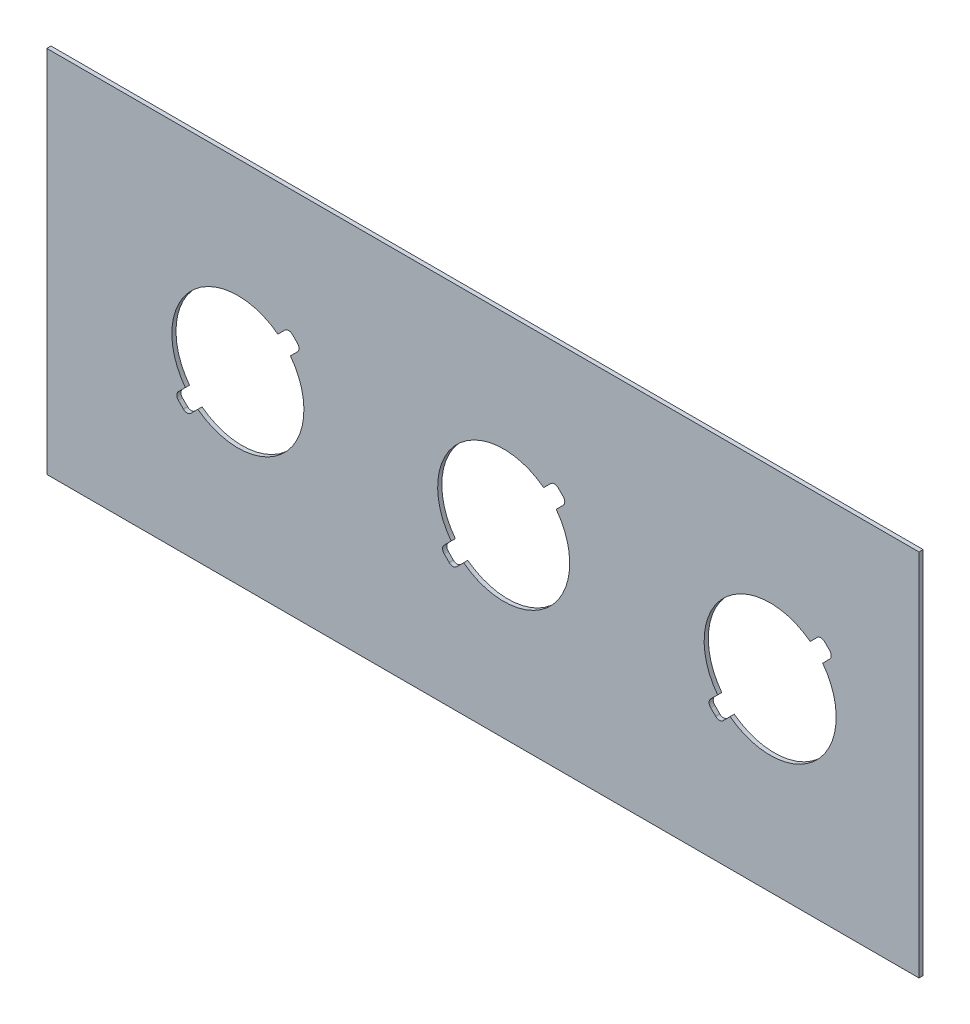
from build123d import *

# Parameters (mm, degrees)
SKETCH1_W           = 330.2
SKETCH1_H           = 139.7
BOSS_EXTRUDE1_DEPTH = 1.5748
SKETCH6_R           = 25
CUT_EXTRUDE3_DEPTH  = 180.27496338
CUT_EXTRUDE4_DEPTH  = 4


with BuildPart() as part:
    # Sketch1 → Boss-Extrude1 (new body)
    with BuildSketch(Plane.XY):
        Rectangle(SKETCH1_W, SKETCH1_H)
    extrude(amount=BOSS_EXTRUDE1_DEPTH)

    # Sketch6 → Cut-Extrude3 (cut, through all)
    with BuildSketch(Plane.XY.offset(1.5748)):
        with Locations((108.75, 0)):
            Circle(SKETCH6_R)
        with Locations((7.861, 0)):
            Circle(SKETCH6_R)
        with Locations((-92.774, 0)):
            Circle(SKETCH6_R)
    extrude(amount=-CUT_EXTRUDE3_DEPTH, mode=Mode.SUBTRACT)

    # Sketch8 → Cut-Extrude4 (cut)
    with BuildSketch(Plane.XY.offset(1.5748)):
        with BuildLine():
            Line((88.120489669, -22.53869864), (86.21130136, -20.629510331))
            ThreePointArc((86.21130136, -20.629510331), (85.625514922, -19.215296769), (86.21130136, -17.801083206))
            Line((86.21130136, -17.801083206), (88.862951789, -15.149432777))
            ThreePointArc((88.862951789, -15.149432777), (91.07233047, -17.67766953), (93.600567223, -19.887048211))
            Line((93.600567223, -19.887048211), (90.948916794, -22.53869864))
            ThreePointArc((90.948916794, -22.53869864), (89.534703231, -23.124485078), (88.120489669, -22.53869864))
        make_face()
        with BuildLine():
            Line((131.28869864, 17.801083206), (128.637048211, 15.149432777))
            ThreePointArc((128.637048211, 15.149432777), (126.42766953, 17.67766953), (123.899432777, 19.887048211))
            Line((123.899432777, 19.887048211), (126.551083206, 22.53869864))
            ThreePointArc((126.551083206, 22.53869864), (127.965296769, 23.124485078), (129.379510331, 22.53869864))
            Line((129.379510331, 22.53869864), (131.28869864, 20.629510331))
            ThreePointArc((131.28869864, 20.629510331), (131.874485078, 19.215296769), (131.28869864, 17.801083206))
        make_face()
        with BuildLine():
            Line((30.39969864, 17.801083206), (27.748048211, 15.149432777))
            ThreePointArc((27.748048211, 15.149432777), (25.53866953, 17.67766953), (23.010432777, 19.887048211))
            Line((23.010432777, 19.887048211), (25.662083206, 22.53869864))
            ThreePointArc((25.662083206, 22.53869864), (27.076296769, 23.124485078), (28.490510331, 22.53869864))
            Line((28.490510331, 22.53869864), (30.39969864, 20.629510331))
            ThreePointArc((30.39969864, 20.629510331), (30.985485078, 19.215296769), (30.39969864, 17.801083206))
        make_face()
        with BuildLine():
            Line((-7.288432777, -19.887048211), (-9.940083206, -22.53869864))
            ThreePointArc((-9.940083206, -22.53869864), (-11.354296769, -23.124485078), (-12.768510331, -22.53869864))
            Line((-12.768510331, -22.53869864), (-14.67769864, -20.629510331))
            ThreePointArc((-14.67769864, -20.629510331), (-15.263485078, -19.215296769), (-14.67769864, -17.801083206))
            Line((-14.67769864, -17.801083206), (-12.026048211, -15.149432777))
            ThreePointArc((-12.026048211, -15.149432777), (-9.81666953, -17.67766953), (-7.288432777, -19.887048211))
        make_face()
        with BuildLine():
            Line((-115.31269864, -17.801083206), (-112.661048211, -15.149432777))
            ThreePointArc((-112.661048211, -15.149432777), (-110.45166953, -17.67766953), (-107.923432777, -19.887048211))
            Line((-107.923432777, -19.887048211), (-110.575083206, -22.53869864))
            ThreePointArc((-110.575083206, -22.53869864), (-111.989296769, -23.124485078), (-113.403510331, -22.53869864))
            Line((-113.403510331, -22.53869864), (-115.31269864, -20.629510331))
            ThreePointArc((-115.31269864, -20.629510331), (-115.898485078, -19.215296769), (-115.31269864, -17.801083206))
        make_face()
        with BuildLine():
            Line((-70.23530136, 17.801083206), (-72.886951789, 15.149432777))
            ThreePointArc((-72.886951789, 15.149432777), (-75.09633047, 17.67766953), (-77.624567223, 19.887048211))
            Line((-77.624567223, 19.887048211), (-74.972916794, 22.53869864))
            ThreePointArc((-74.972916794, 22.53869864), (-73.558703231, 23.124485078), (-72.144489669, 22.53869864))
            Line((-72.144489669, 22.53869864), (-70.23530136, 20.629510331))
            ThreePointArc((-70.23530136, 20.629510331), (-69.649514922, 19.215296769), (-70.23530136, 17.801083206))
        make_face()
    extrude(amount=-CUT_EXTRUDE4_DEPTH, mode=Mode.SUBTRACT)


solid = part.part
